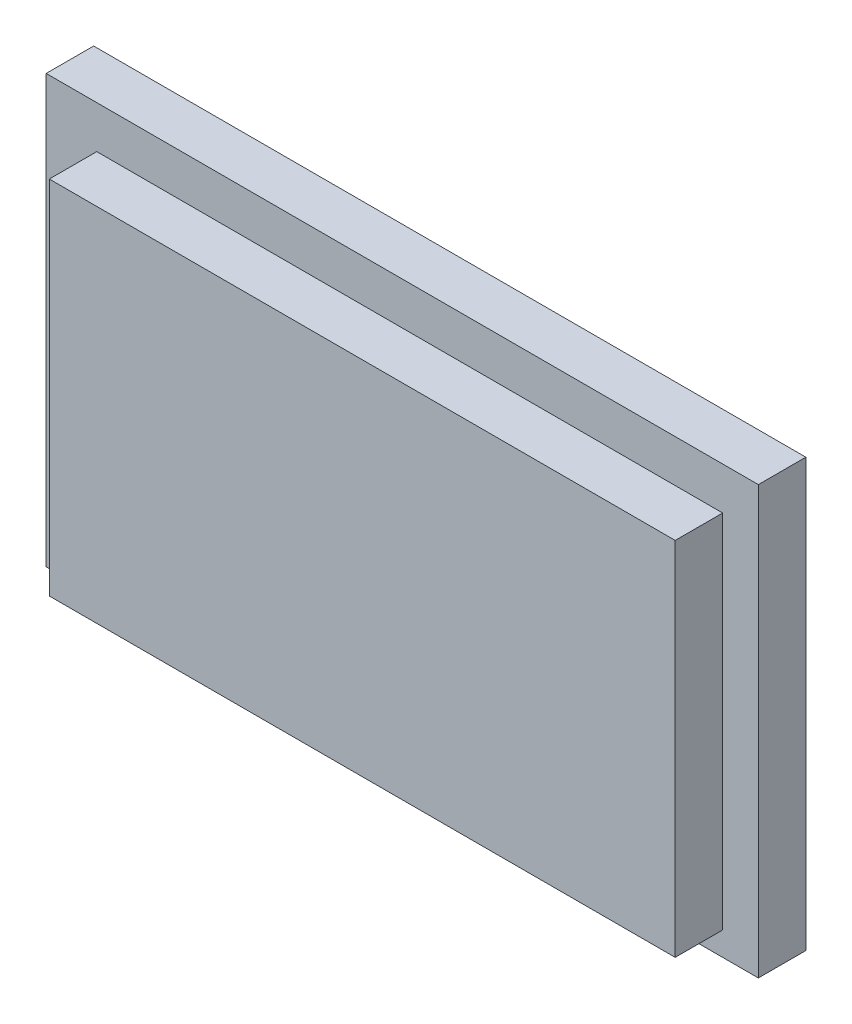
from build123d import *

# Parameters (mm, degrees)
SKETCH_2_W      = 30
SKETCH_2_H      = 18
EXTRUDE_1_DEPTH = 2
SKETCH_3_W      = 26.365527772
SKETCH_3_H      = 15.21186307
EXTRUDE_2_DEPTH = 2


with BuildPart() as part:
    # 草图2 → 凸台-拉伸1 (new body)
    with BuildSketch(Plane.XY):
        with Locations((-1.597842145, 1.067544451)):
            Rectangle(SKETCH_2_W, SKETCH_2_H)
    extrude(amount=EXTRUDE_1_DEPTH)

    # 草图3 → 凸台-拉伸2 (add)
    with BuildSketch(Plane.XY.offset(2)):
        with Locations((-1.283460156, 0.674317114)):
            Rectangle(SKETCH_3_W, SKETCH_3_H)
    extrude(amount=EXTRUDE_2_DEPTH)


solid = part.part
